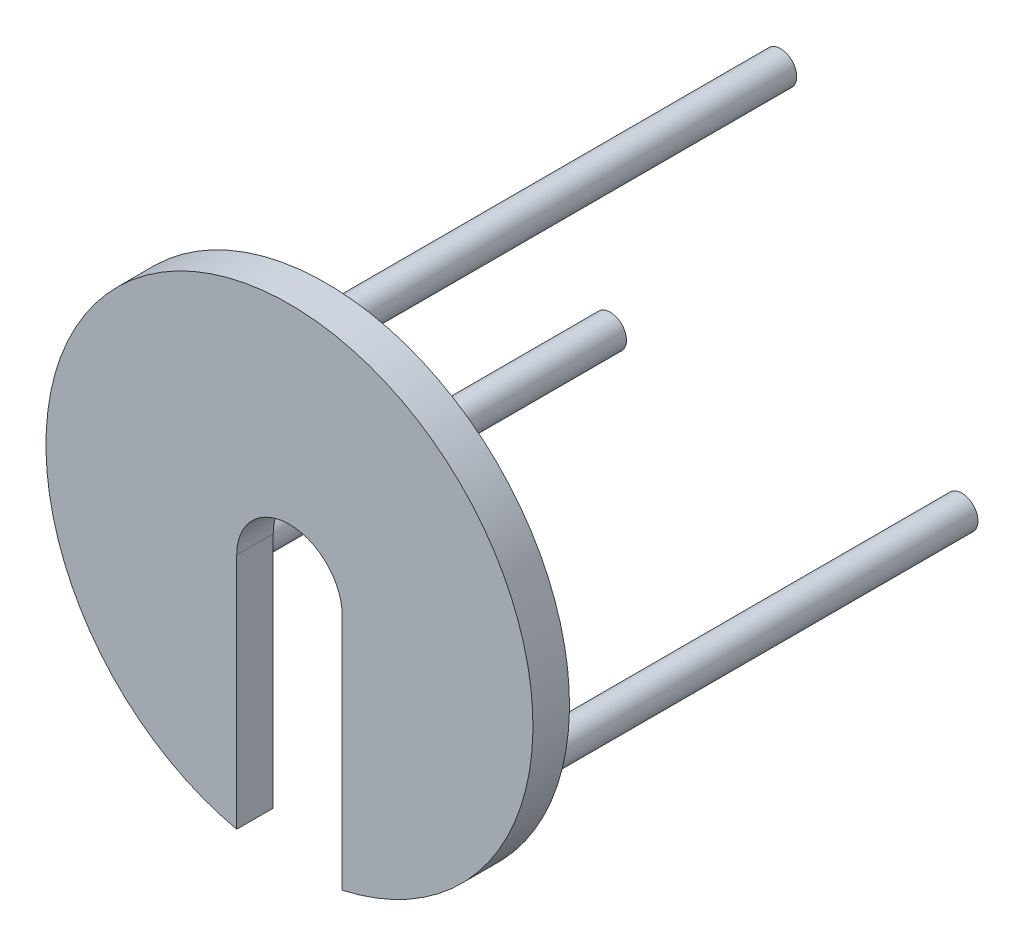
from build123d import *

# Parameters (mm, degrees)
EXTRUDE_1_DEPTH      = 3
EXTRUDE_1_DEPTH_BACK = 6
SKETCH_2_R           = 60
SKETCH_5_R           = 4
EXTRUDE_2_DEPTH      = 112
SKETCH_6_R           = 4
EXTRUDE_3_DEPTH      = 112
SKETCH_7_R           = 13
CUT_EXTRUDE_2_DEPTH  = 20
SKETCH_14_W          = 26
SKETCH_14_H          = 65
CUT_EXTRUDE_3_DEPTH  = 10


with BuildPart() as part:
    # 草图2 → 凸台-拉伸1 (new, two sides: drawn at the far end of the back side and taken through both)
    with BuildSketch(Plane.XY.offset(-EXTRUDE_1_DEPTH_BACK)):
        Circle(SKETCH_2_R)
    extrude(amount=EXTRUDE_1_DEPTH + EXTRUDE_1_DEPTH_BACK)

    # 草图5 → 凸台-拉伸2 (add)
    with BuildSketch(Plane(origin=(0, 0, -6), x_dir=(-1, 0, 0), z_dir=(0, 0, -1))):
        with Locations(Location((0, 50, 0), (0, 0, 180))):
            Circle(SKETCH_5_R)
    extrude(amount=EXTRUDE_2_DEPTH)

    # 草图6 → 凸台-拉伸3 (add)
    with BuildSketch(Plane(origin=(0, 0, -6), x_dir=(-1, 0, 0), z_dir=(0, 0, -1))):
        with Locations(Location((-44.655818583, -22.491284238, 0), (0, 0, 180))):
            Circle(SKETCH_6_R)
        with Locations(Location((41.95168902, -27.203966409, 0), (0, 0, 180))):
            Circle(SKETCH_6_R)
    extrude(amount=EXTRUDE_3_DEPTH)

    # 草图7 → 切除-拉伸2 (cut)
    with BuildSketch(Plane.XY.offset(3)):
        Circle(SKETCH_7_R)
    extrude(amount=-CUT_EXTRUDE_2_DEPTH, mode=Mode.SUBTRACT)

    # 草图14 → 切除-拉伸3 (cut)
    with BuildSketch(Plane.XY.offset(3)):
        with Locations((0, -32.5)):
            Rectangle(SKETCH_14_W, SKETCH_14_H)
    extrude(amount=-CUT_EXTRUDE_3_DEPTH, mode=Mode.SUBTRACT)


solid = part.part
